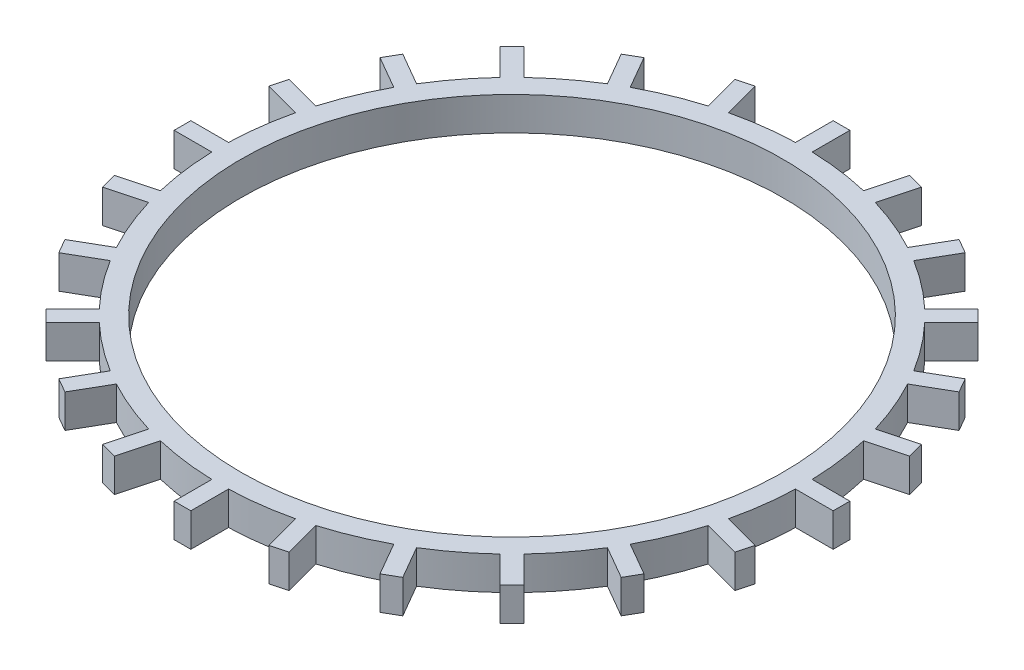
from build123d import *

# Parameters (mm, degrees)
BOSS_EXTRU_1_DEPTH           = 1.6
BOSS_EXTRU_2_DEPTH           = 1.6
R_P_TITION_CIRCULAIRE1_COUNT = 24


with BuildPart() as part:
    # Esquisse1 → Boss.-Extru.1 (new body)
    with BuildSketch(Plane(origin=(0, 0, 0), x_dir=(1, 0, 0), z_dir=(0, 1, 0))):
        with BuildLine():
            ThreePointArc((12.993844697, -0.4), (-13, 0), (12.993844697, 0.4))
            Line((12.993844697, 0.4), (13.994284548, 0.4))
            ThreePointArc((13.994284548, 0.4), (-14, 0), (13.994284548, -0.4))
            Line((13.994284548, -0.4), (12.993844697, -0.4))
        make_face()
        with BuildLine():
            Line((13.994284548, 0.4), (12.993844697, 0.4))
            ThreePointArc((12.993844697, 0.4), (12.998461083, 0.200023678), (13, 0))
            ThreePointArc((13, 0), (12.998461083, -0.200023678), (12.993844697, -0.4))
            Line((12.993844697, -0.4), (13.994284548, -0.4))
            ThreePointArc((13.994284548, -0.4), (13.998571064, -0.200020415), (14, 0))
            ThreePointArc((14, 0), (13.998571064, 0.200020415), (13.994284548, 0.4))
        make_face()
    extrude(amount=BOSS_EXTRU_1_DEPTH)

    # Esquisse1<3> → Boss.-Extru.2 (add)
    with BuildSketch(Plane(origin=(0, 0, 0), x_dir=(1, 0, 0), z_dir=(0, 1, 0))):
        with BuildLine():
            Line((15.8, 0.4), (13.994284548, 0.4))
            ThreePointArc((13.994284548, 0.4), (13.998571064, 0.200020415), (14, 0))
            ThreePointArc((14, 0), (13.998571064, -0.200020415), (13.994284548, -0.4))
            Line((13.994284548, -0.4), (15.8, -0.4))
            Line((15.8, -0.4), (15.8, 0.4))
        make_face()
    boss_extru_2 = extrude(amount=BOSS_EXTRU_2_DEPTH)

    # Répétition circulaire1: Boss.-Extru.2 ×24 about axis
    r_p_tition_circulaire1_axis = Axis((0, 0, 0), (0, 1, 0))
    for i in range(1, R_P_TITION_CIRCULAIRE1_COUNT):
        add(boss_extru_2.rotate(r_p_tition_circulaire1_axis, i * 360 / R_P_TITION_CIRCULAIRE1_COUNT))


solid = part.part
